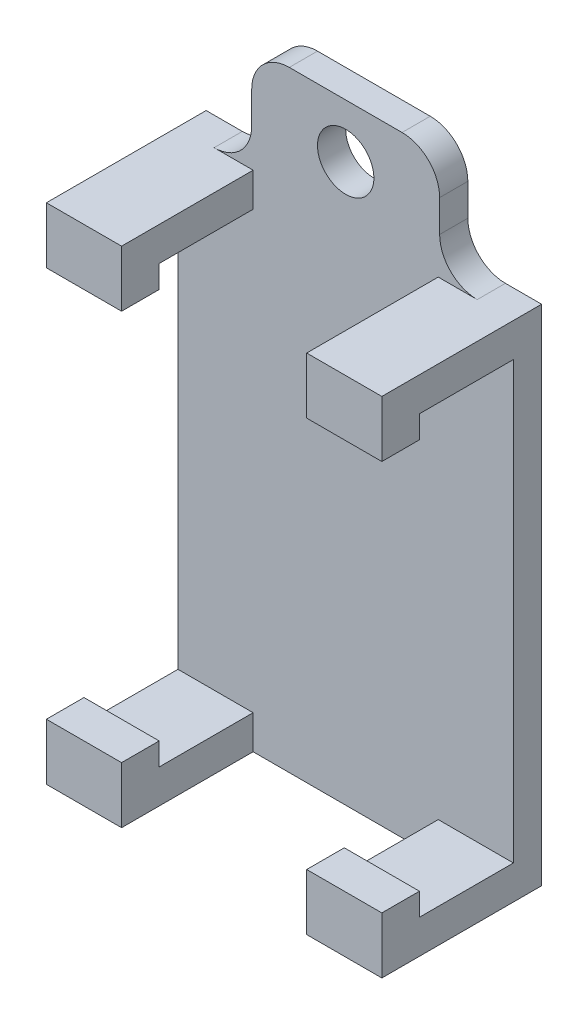
from build123d import *

# Parameters (mm, degrees)
SKETCH1_W             = 17.85
SKETCH1_H             = 38.2
BOSS_EXTRUDE1_DEPTH   = 1.5
SKETCH2_W             = 17.85
SKETCH2_H             = 3
BOSS_EXTRUDE2_DEPTH   = 7
SKETCH3_W             = 17.85
SKETCH3_H             = 5
CUT_EXTRUDE1_DEPTH    = 1.2
SKETCH4_W             = 17.85
SKETCH4_H             = 5
CUT_EXTRUDE2_DEPTH    = 1.2
SKETCH5_R             = 1.5
CUT_EXTRUDE3_DEPTH    = 43.741812081
SKETCH7_W             = 17.85
SKETCH7_H             = 5.7
CUT_EXTRUDE4_DEPTH    = 44.012934101
SKETCH8_W             = 9.85
SKETCH8_H             = 7
CUT_EXTRUDE5_DEPTH    = 39.04106334
SKETCH9_W             = 3.925
SKETCH9_H             = 5.7
CUT_EXTRUDE6_DEPTH    = 43.741812081
FILLET1_R             = 2
BODY_MOVE_COPY1_ANGLE = 90


with BuildPart() as part:
    # Sketch1 → Boss-Extrude1 (new body)
    with BuildSketch(Plane(origin=(0, 0, 0), x_dir=(1, 0, 0), z_dir=(0, 1, 0))):
        with Locations((8.925, 19.1)):
            Rectangle(SKETCH1_W, SKETCH1_H)
    extrude(amount=BOSS_EXTRUDE1_DEPTH)

    # Sketch2 → Boss-Extrude2 (add)
    with BuildSketch(Plane(origin=(0, 1.5, 0), x_dir=(1, 0, 0), z_dir=(0, 1, 0))):
        with Locations((8.925, 31)):
            Rectangle(SKETCH2_W, SKETCH2_H)
        with Locations((8.925, 7.2)):
            Rectangle(SKETCH2_W, SKETCH2_H)
    extrude(amount=BOSS_EXTRUDE2_DEPTH)

    # Sketch3 → Cut-Extrude1 (cut)
    with BuildSketch(Plane.XY.offset(-29.5)):
        with Locations((8.925, 4)):
            Rectangle(SKETCH3_W, SKETCH3_H)
    extrude(amount=-CUT_EXTRUDE1_DEPTH, mode=Mode.SUBTRACT)

    # Sketch4 → Cut-Extrude2 (cut)
    with BuildSketch(Plane(origin=(0, 0, -8.7), x_dir=(-1, 0, 0), z_dir=(0, 0, -1))):
        with Locations((-8.925, 4)):
            Rectangle(SKETCH4_W, SKETCH4_H)
    extrude(amount=-CUT_EXTRUDE2_DEPTH, mode=Mode.SUBTRACT)

    # Sketch5 → Cut-Extrude3 (cut, through all)
    with BuildSketch(Plane(origin=(0, 1.5, 0), x_dir=(1, 0, 0), z_dir=(0, 1, 0))):
        with Locations(Location((8.925, 35.35, 0), (0, 0, 270))):
            Circle(SKETCH5_R)
        with Locations(Location((8.925, 2.85, 0), (0, 0, 270))):
            Circle(SKETCH5_R)
    extrude(amount=-CUT_EXTRUDE3_DEPTH, mode=Mode.SUBTRACT)

    # Sketch7 → Cut-Extrude4 (cut, through all)
    with BuildSketch(Plane(origin=(0, 0, 0), x_dir=(1, 0, 0), z_dir=(0, 1, 0))):
        with Locations((8.925, 2.85)):
            Rectangle(SKETCH7_W, SKETCH7_H)
    extrude(amount=CUT_EXTRUDE4_DEPTH, mode=Mode.SUBTRACT)

    # Sketch8 → Cut-Extrude5 (cut, through all)
    with BuildSketch(Plane.XY.offset(-5.7)):
        with Locations((8.925, 5)):
            Rectangle(SKETCH8_W, SKETCH8_H)
    extrude(amount=-CUT_EXTRUDE5_DEPTH, mode=Mode.SUBTRACT)

    # Sketch9 → Cut-Extrude6 (cut, through all)
    with BuildSketch(Plane(origin=(0, 1.5, 0), x_dir=(1, 0, 0), z_dir=(0, 1, 0))):
        with Locations((1.9625, 35.35)):
            Rectangle(SKETCH9_W, SKETCH9_H)
        with Locations((15.8875, 35.35)):
            Rectangle(SKETCH9_W, SKETCH9_H)
    extrude(amount=-CUT_EXTRUDE6_DEPTH, mode=Mode.SUBTRACT)

    # Fillet1
    fillet1_edges = [part.edges().sort_by_distance(p)[0] for p in [
        (3.925, 0.75, -38.2),
        (3.925, 0.75, -32.5),
        (13.925, 0.75, -38.2),
        (13.925, 0.75, -32.5),
    ]]
    fillet(fillet1_edges, radius=FILLET1_R)


with BuildPart() as part_1:
    # Body-Move/Copy1: moved
    add(part.part.rotate(Axis((0, 2.75, -20.7), (1, 0, 0)), BODY_MOVE_COPY1_ANGLE))


solid = part_1.part
